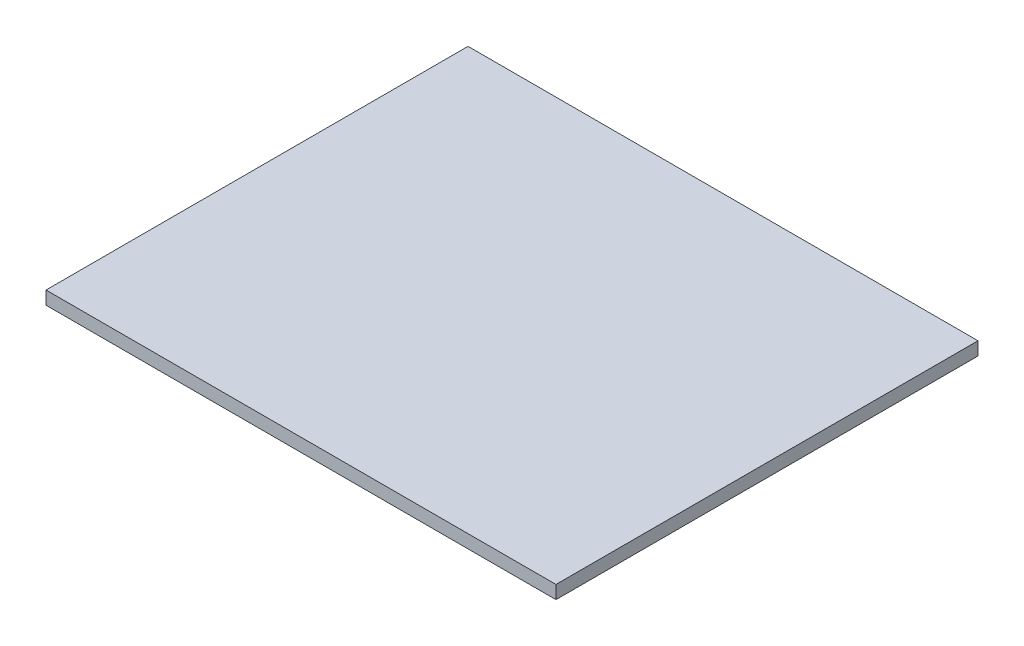
from build123d import *

# Parameters (mm, degrees)
SKETCH1_W           = 736.6
SKETCH1_H           = 609.6
BOSS_EXTRUDE1_DEPTH = 19.05


with BuildPart() as part:
    # Sketch1 → Boss-Extrude1 (new body)
    with BuildSketch(Plane(origin=(0, 0, 0), x_dir=(1, 0, 0), z_dir=(0, 1, 0))):
        with Locations((368.3, 304.8)):
            Rectangle(SKETCH1_W, SKETCH1_H)
    extrude(amount=BOSS_EXTRUDE1_DEPTH)


solid = part.part
